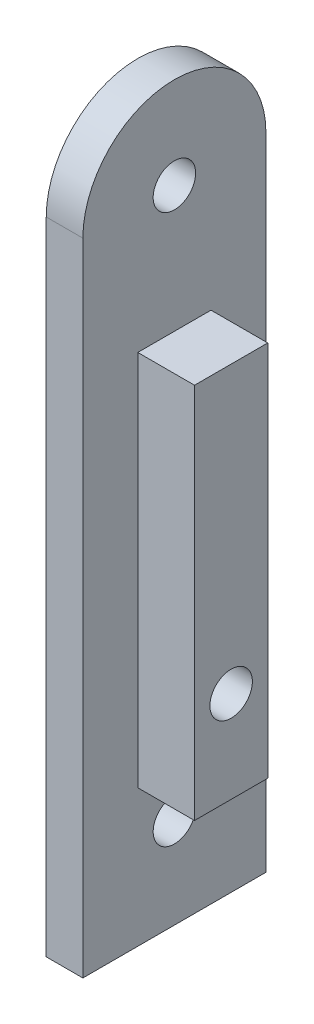
from build123d import *

# Parameters (mm, degrees)
BOSS_EXTRUDE1_DEPTH     = 2.54
SKETCH2_W               = 5.08
SKETCH2_H               = 26.152706233
BOSS_EXTRUDE2_DEPTH     = 3.937
CUT_EXTRUDE1_DEPTH      = 46.366028358
CUT_EXTRUDE1_DEPTH_BACK = 46.366028358
SKETCH3_R               = 1.4732
F_4_CLEARANCE_HOLE1_D   = 2.9464


with BuildPart() as part:
    # Sketch1 → Boss-Extrude1 (new body)
    with BuildSketch(Plane(origin=(0, 0, 0), x_dir=(0, 0, -1), z_dir=(1, 0, 0))):
        with BuildLine():
            Line((6.35, -44.45), (6.35, 0))
            ThreePointArc((6.35, 0), (0, 6.35), (-6.35, 0))
            Line((-6.35, 0), (-6.35, -44.45))
            Line((-6.35, -44.45), (6.35, -44.45))
        make_face()
    extrude(amount=BOSS_EXTRUDE1_DEPTH)

    # Sketch2 → Boss-Extrude2 (add)
    with BuildSketch(Plane(origin=(2.54, 0, 0), x_dir=(0, 0, -1), z_dir=(1, 0, 0))):
        with Locations((0, -21.848646884)):
            Rectangle(SKETCH2_W, SKETCH2_H)
    extrude(amount=BOSS_EXTRUDE2_DEPTH)

    # Sketch3 → Cut-Extrude1 (cut, two sides: drawn at the far end of the back side and taken through both)
    with BuildSketch(Plane.ZY.offset(-CUT_EXTRUDE1_DEPTH_BACK)):
        with Locations(Location((0, 0, 0), (0, 0, 180))):
            Circle(SKETCH3_R)
    extrude(amount=CUT_EXTRUDE1_DEPTH + CUT_EXTRUDE1_DEPTH_BACK, mode=Mode.SUBTRACT)

    # #4 Clearance Hole1 (through all)
    with Locations(Plane.ZY):
        with Locations((0, -28.575), (0, -38.1)):
            Hole(F_4_CLEARANCE_HOLE1_D / 2)


solid = part.part
